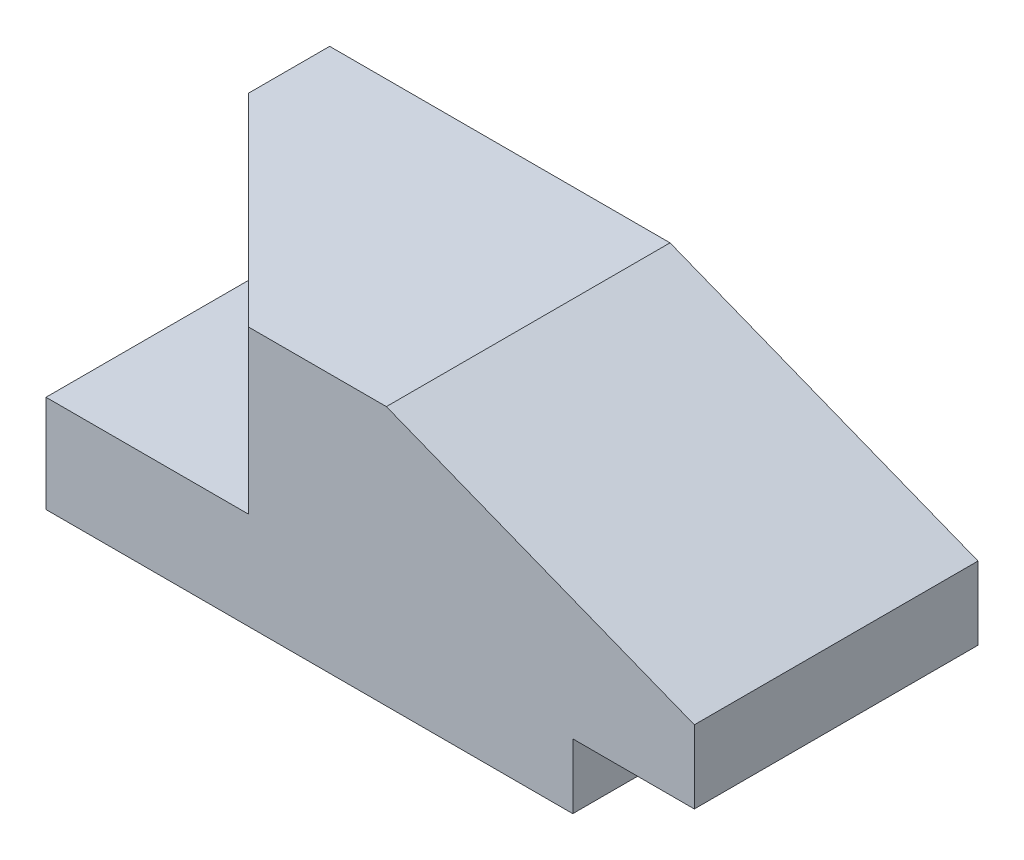
from build123d import *

# Parameters (mm, degrees)
BOSS_EXTRUDE1_DEPTH = 35
CUT_EXTRUDE1_DEPTH  = 20


with BuildPart() as part:
    # Sketch1 → Boss-Extrude1 (new body)
    with BuildSketch(Plane.XY):
        Polygon((0, 0), (0, -8), (-65, -8), (-65, 4), (-65, 24), (-40, 24), (-23, 24), (15, 9), (15, 0), align=None)
    extrude(amount=-BOSS_EXTRUDE1_DEPTH)

    # Sketch2 → Cut-Extrude1 (cut)
    with BuildSketch(Plane(origin=(0, 24, 0), x_dir=(1, 0, 0), z_dir=(0, 1, 0))):
        Polygon((-40, 0), (-65, 25), (-65, 0), align=None)
    extrude(amount=-CUT_EXTRUDE1_DEPTH, mode=Mode.SUBTRACT)


solid = part.part
